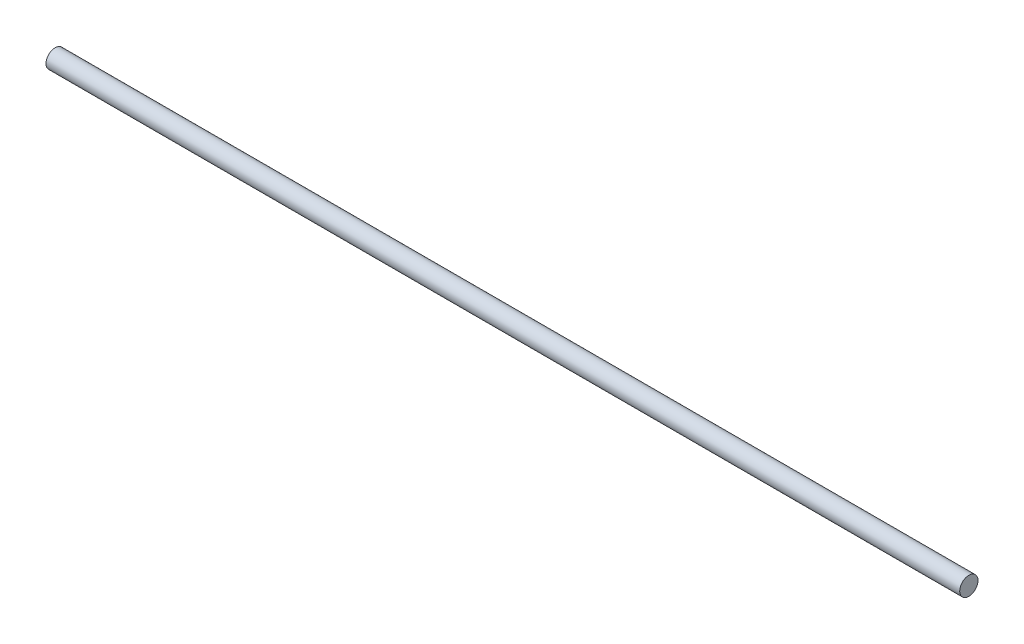
from build123d import *

# Parameters (mm, degrees)
SKETCH1_R           = 1.5
BOSS_EXTRUDE1_DEPTH = 150


with BuildPart() as part:
    # Sketch1 → Boss-Extrude1 (new body)
    with BuildSketch(Plane(origin=(0, 0, 0), x_dir=(0, 0, -1), z_dir=(1, 0, 0))):
        Circle(SKETCH1_R)
    extrude(amount=BOSS_EXTRUDE1_DEPTH)


solid = part.part
